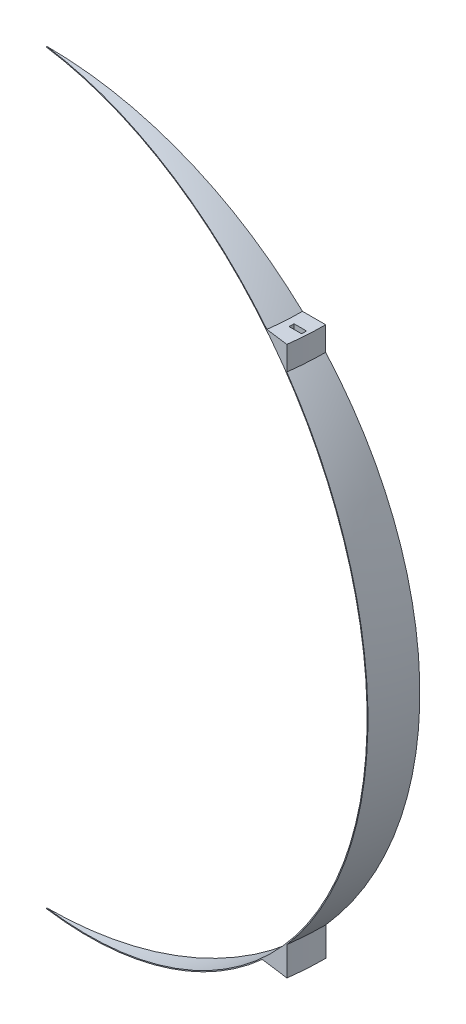
from build123d import *

# Parameters (mm, degrees)
REVOLVE2_ANGLE     = 7.5
SKETCH4_W          = 33.25
SKETCH4_H          = 13
CUT_EXTRUDE5_DEPTH = 19
SKETCH7_W          = 33.25
SKETCH7_H          = 13
CUT_EXTRUDE7_DEPTH = 19


with BuildPart() as part:
    # Sketch2 → Revolve2 (revolve)
    with BuildSketch(Plane.XY):
        with BuildLine():
            Line((0, 993.075249624), (0, 990.6))
            ThreePointArc((0, 990.6), (990.6, 0), (0, -990.6))
            Line((0, -990.6), (0, -993.075249624))
            ThreePointArc((0, -993.075249624), (357.30221933, -926.570869107), (666.748724276, -735.965073963))
            Line((666.748724276, -735.965073963), (742.973100692, -735.965073963))
            Line((742.973100692, -735.965073963), (742.973100692, -658.930514596))
            ThreePointArc((742.973100692, -658.930514596), (993.075236283, 0.162783709), (742.757038562, 659.174053709))
            Line((742.757038562, 659.174053709), (742.757038562, 722.715073963))
            Line((742.757038562, 722.715073963), (681.088374063, 722.715073963))
            ThreePointArc((681.088374063, 722.715073963), (366.393230651, 923.013787519), (0, 993.075249624))
        make_face()
    revolve(axis=Axis((0, 993.075249624, 0), (0, -1, 0)), revolution_arc=REVOLVE2_ANGLE)

    # Sketch4 → Cut-Extrude5 (cut)
    with BuildSketch(Plane.XZ.offset(735.965073963)):
        with Locations((705.258501449, 49.061390401)):
            Rectangle(SKETCH4_W, SKETCH4_H)
    extrude(amount=-CUT_EXTRUDE5_DEPTH, mode=Mode.SUBTRACT)

    # Sketch7 → Cut-Extrude7 (cut)
    with BuildSketch(Plane(origin=(0, 722.715073963, 0), x_dir=(-1, 0, 0), z_dir=(0, 1, 0))):
        with Locations((-714.999743141, 46.422731407)):
            Rectangle(SKETCH7_W, SKETCH7_H)
    extrude(amount=-CUT_EXTRUDE7_DEPTH, mode=Mode.SUBTRACT)


solid = part.part
